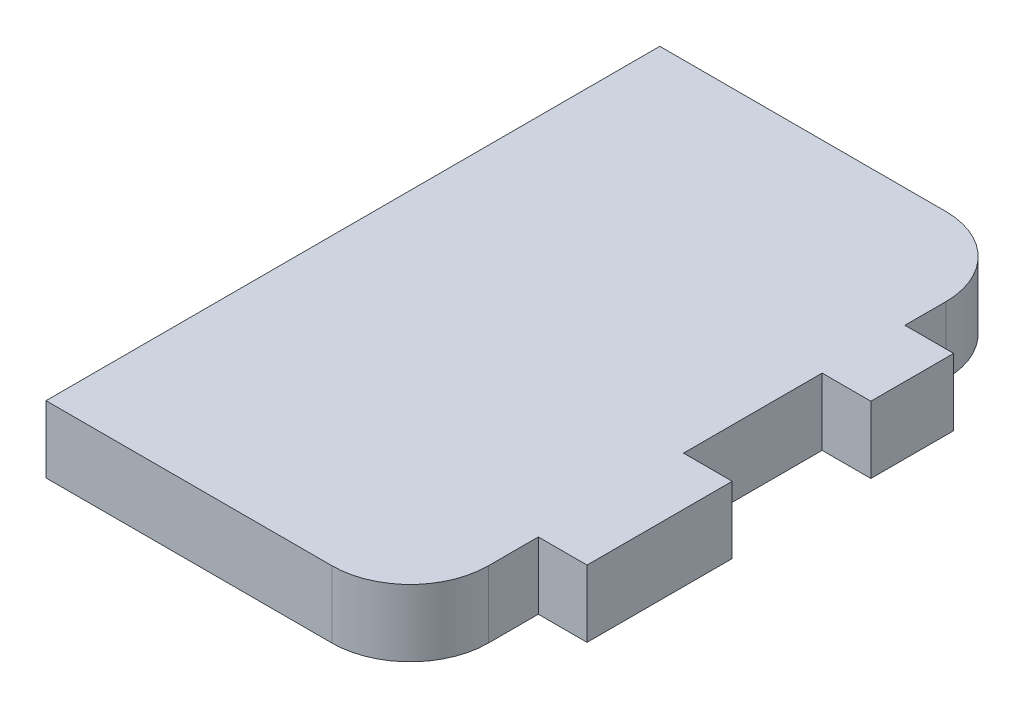
from build123d import *

# Parameters (mm, degrees)
SKETCH1_W           = 37
SKETCH1_H           = 55
BOSS_EXTRUDE1_DEPTH = 6
SKETCH2_W           = 4.36600783
SKETCH2_H           = 10.66713821
SKETCH2_H_2         = 12.422520393
SKETCH2_H_3         = 11.48339845
CUT_EXTRUDE1_DEPTH  = 67.558245169
FILLET1_R           = 7


with BuildPart() as part:
    # Sketch1 → Boss-Extrude1 (new body)
    with BuildSketch(Plane(origin=(0, 0, 0), x_dir=(1, 0, 0), z_dir=(0, 1, 0))):
        with Locations((18.5, 27.5)):
            Rectangle(SKETCH1_W, SKETCH1_H)
    extrude(amount=BOSS_EXTRUDE1_DEPTH)

    # Sketch2 → Cut-Extrude1 (cut, through all)
    with BuildSketch(Plane(origin=(0, 6, 0), x_dir=(1, 0, 0), z_dir=(0, 1, 0))):
        with Locations((34.816996085, 49.666430895)):
            Rectangle(SKETCH2_W, SKETCH2_H)
        with Locations((34.816996085, 30.703899365)):
            Rectangle(SKETCH2_W, SKETCH2_H_2)
        with Locations((34.816996085, 5.741699225)):
            Rectangle(SKETCH2_W, SKETCH2_H_3)
    extrude(amount=-CUT_EXTRUDE1_DEPTH, mode=Mode.SUBTRACT)

    # Fillet1
    fillet1_edges = [part.edges().sort_by_distance(p)[0] for p in [
        (32.63399217, 3, -55),
        (32.63399217, 3, 0),
    ]]
    fillet(fillet1_edges, radius=FILLET1_R)


solid = part.part
